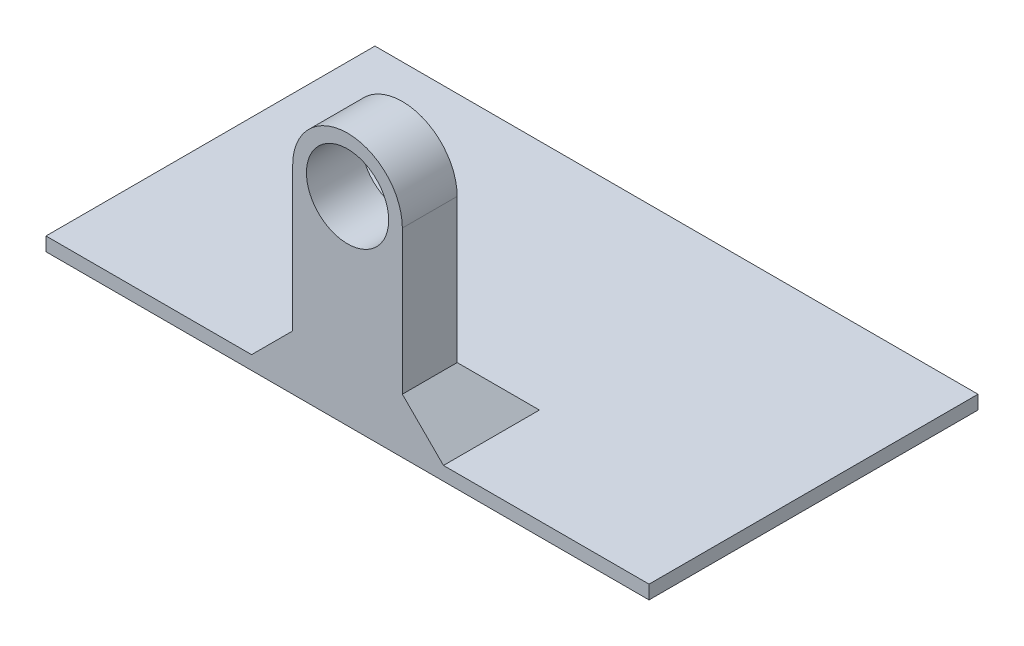
from build123d import *

# Parameters (mm, degrees)
ESBO_O1_W                = 220
ESBO_O1_H                = 120
RESSALTO_EXTRUS_O1_DEPTH = 5
ESBO_O2_R                = 15
RESSALTO_EXTRUS_O2_DEPTH = 20
CHANFRO1_SIZE            = 15


with BuildPart() as part:
    # Esboço1 → Ressalto-extrusão1 (new body)
    with BuildSketch(Plane(origin=(0, 0, 0), x_dir=(1, 0, 0), z_dir=(0, 1, 0))):
        Rectangle(ESBO_O1_W, ESBO_O1_H)
    extrude(amount=RESSALTO_EXTRUS_O1_DEPTH)

    # Esboço2 → Ressalto-extrusão2 (add)
    with BuildSketch(Plane.XY.offset(60)):
        with BuildLine():
            Line((20, 72.5), (20, 5))
            Line((20, 5), (-20, 5))
            Line((-20, 5), (-20, 72.5))
            ThreePointArc((-20, 72.5), (0, 92.5), (20, 72.5))
        make_face()
        with Locations((0, 72.5)):
            Circle(ESBO_O2_R, mode=Mode.SUBTRACT)
    extrude(amount=-RESSALTO_EXTRUS_O2_DEPTH)

    # Chanfro1
    chanfro1_edges = [part.edges().sort_by_distance(p)[0] for p in [
        (0, 5, 40),
        (20, 5, 50),
        (-20, 5, 50),
    ]]
    chamfer(chanfro1_edges, length=CHANFRO1_SIZE)


solid = part.part
